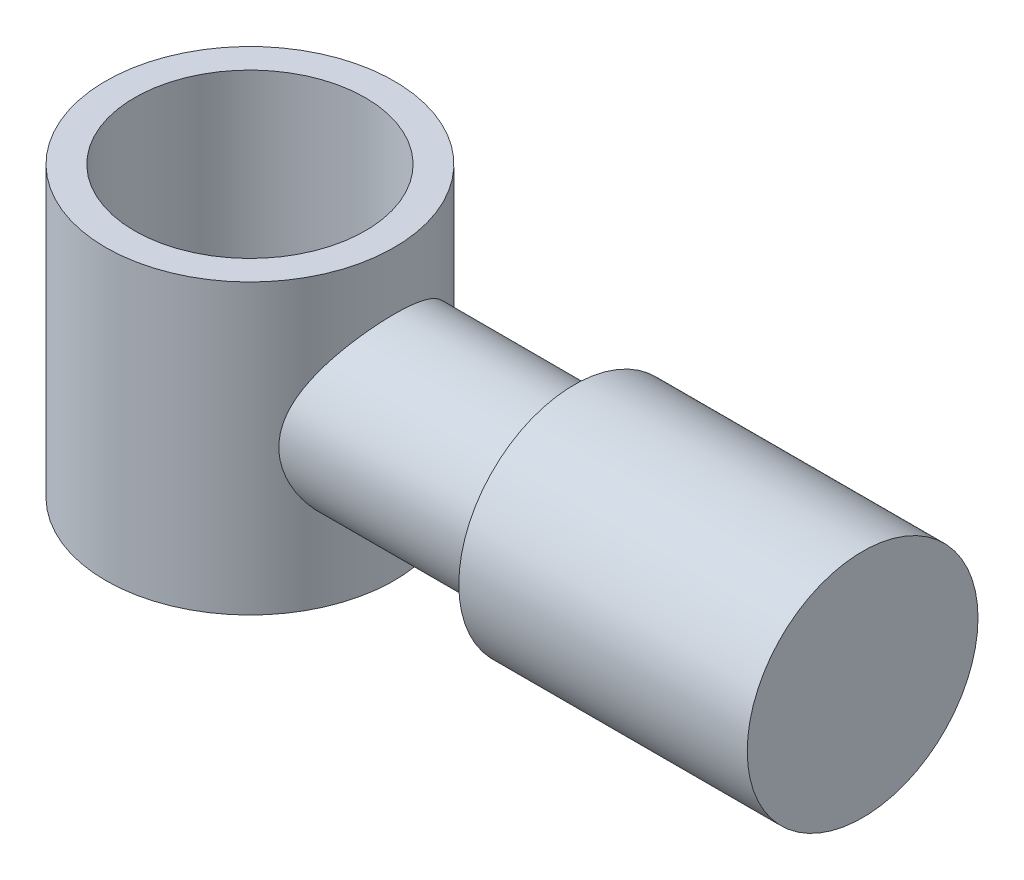
from build123d import *

# Parameters (mm, degrees)
SKETCH_1_R           = 50
SKETCH_1_R_2         = 40
EXTRUDE_1_DEPTH      = 50
SKETCH_2_R           = 40
EXTRUDE_2_DEPTH      = 50
EXTRUDE_3_REACH      = 179.126
EXTRUDE_3_END_RADIUS = 50
SKETCH_4_R           = 30


with BuildPart() as part:
    # 草图1 → 凸台-拉伸1 (new, symmetric)
    with BuildSketch(Plane(origin=(0, 0, 0), x_dir=(1, 0, 0), z_dir=(0, 1, 0))):
        with Locations(Location((0, 0, 0), (0, 0, 270))):
            Circle(SKETCH_1_R)
        with Locations(Location((0, 0, 0), (0, 0, 270))):
            Circle(SKETCH_1_R_2, mode=Mode.SUBTRACT)
    extrude(amount=EXTRUDE_1_DEPTH, both=True)


with BuildPart() as body_2:
    # 草图2 → 凸台-拉伸2 (new, symmetric)
    with BuildSketch(Plane(origin=(162.4, 0, 0), x_dir=(0, 0, -1), z_dir=(1, 0, 0))):
        Circle(SKETCH_2_R)
    extrude(amount=EXTRUDE_2_DEPTH, both=True)


with BuildPart() as body_3:
    # 凸台-拉伸3: up to this cylinder (the profile starts outside it)
    extrude_3_end = Plane(origin=(0, 0, 0), z_dir=(0, -1, 0)) * Cylinder(EXTRUDE_3_END_RADIUS, 459.252, mode=Mode.PRIVATE)
    # 草图4 → 凸台-拉伸3 (new, up to the surface)
    with BuildSketch(Plane.ZY.offset(-112.4), mode=Mode.PRIVATE) as extrude_3_sk1:
        with Locations(Location((0, 0, 0), (0, 0, 180))):
            Circle(SKETCH_4_R)
    extrude_3_tool1 = extrude(extrude_3_sk1.sketch, amount=EXTRUDE_3_REACH, mode=Mode.PRIVATE) - extrude_3_end
    add(extrude_3_tool1.solids().sort_by_distance((112.4, 0, 0))[0])


solid = Compound([part.part, body_2.part, body_3.part])
